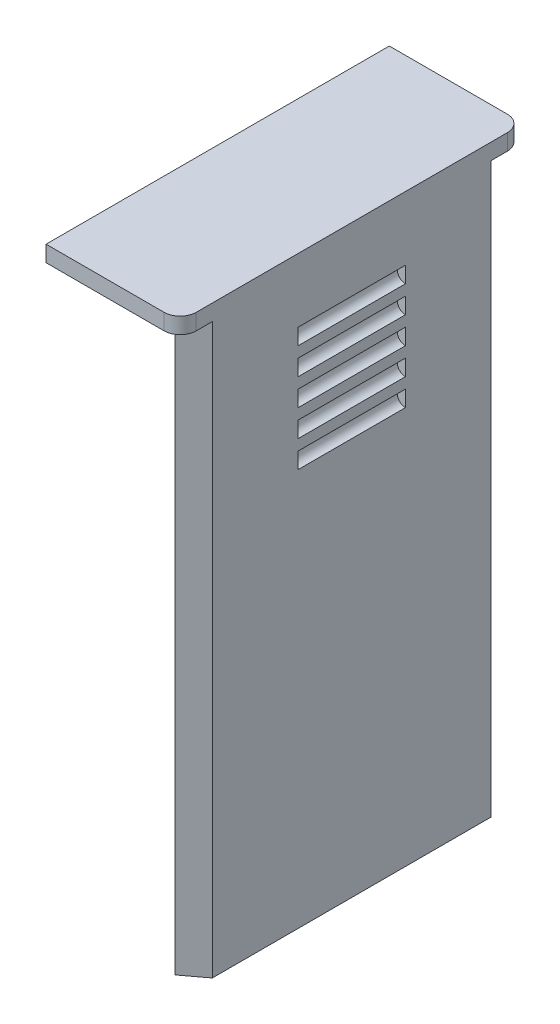
from build123d import *

# Parameters (mm, degrees)
CROQUIS1_W              = 12.5
CROQUIS1_H              = 32
SALIENTE_EXTRUIR1_DEPTH = 1.5
SALIENTE_EXTRUIR2_DEPTH = 53
CROQUIS5_W              = 1
CROQUIS5_H              = 15
SALIENTE_EXTRUIR4_DEPTH = 20
CROQUIS4_R              = 0.75
CORTAR_EXTRUIR1_DEPTH   = 5
REDONDEO1_R             = 1.5


with BuildPart() as part:
    # Croquis1 → Saliente-Extruir1 (new body)
    with BuildSketch(Plane(origin=(0, 111.467949425, 0), x_dir=(1, 0, 0), z_dir=(0, 1, 0))):
        with Locations((-9.702229413, -88.418391236)):
            Rectangle(CROQUIS1_W, CROQUIS1_H)
    extrude(amount=-SALIENTE_EXTRUIR1_DEPTH)

    # Croquis2 → Saliente-Extruir2 (add)
    with BuildSketch(Plane.XZ.offset(-109.967949425)):
        Polygon((-3.452229413, 101.418391236), (-5.452229413, 102.918391236), (-5.452229413, 73.918391236), (-3.452229413, 75.418391236), align=None)
    extrude(amount=SALIENTE_EXTRUIR2_DEPTH)

    # Croquis5 → Saliente-Extruir4 (add)
    with BuildSketch(Plane.XZ.offset(-109.967949425)):
        with Locations((-5.952229413, 88.418391236)):
            Rectangle(CROQUIS5_W, CROQUIS5_H)
    extrude(amount=SALIENTE_EXTRUIR4_DEPTH)

    # Croquis4 → Cortar-Extruir1 (cut, symmetric)
    with BuildSketch(Plane(origin=(0, 0, 88.418391236), x_dir=(0, -1, 0), z_dir=(0, 0, 1))):
        with Locations((-104.767949425, -3.452229413)):
            Circle(CROQUIS4_R)
        with Locations((-102.267949425, -3.452229413)):
            Circle(CROQUIS4_R)
        with Locations((-99.767949425, -3.452229413)):
            Circle(CROQUIS4_R)
        with Locations((-97.267949425, -3.452229413)):
            Circle(CROQUIS4_R)
        with Locations((-94.767949425, -3.452229413)):
            Circle(CROQUIS4_R)
    extrude(amount=CORTAR_EXTRUIR1_DEPTH, both=True, mode=Mode.SUBTRACT)

    # Redondeo1
    redondeo1_edges = [part.edges().sort_by_distance(p)[0] for p in [
        (-3.452229413, 110.717949425, 72.418391236),
        (-3.452229413, 110.717949425, 104.418391236),
    ]]
    fillet(redondeo1_edges, radius=REDONDEO1_R)


solid = part.part
